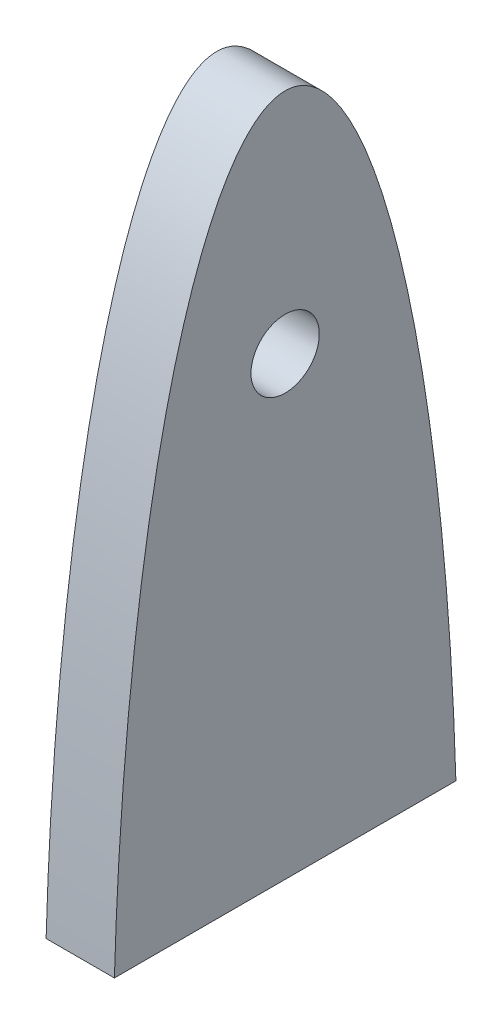
from build123d import *

# Parameters (mm, degrees)
SKETCH1_R           = 1.5
BOSS_EXTRUDE1_DEPTH = 3


with BuildPart() as part:
    # Sketch1 → Boss-Extrude1 (new body)
    with BuildSketch(Plane(origin=(3, 0, 0), x_dir=(0, 0, -1), z_dir=(1, 0, 0))):
        with BuildLine():
            Line((-7.5, 0), (7.5, 0))
            add(Edge.make_bspline(
                [(7.5, 0), (6.6, 30), (0, 30), (-6.6, 30), (-7.5, 0)],
                knots=[4.849178807, 4.849178807, 4.849178807, 6.283185307, 6.283185307, 7.717191807, 7.717191807, 7.717191807], degree=2, weights=[1, 0.753778361, 1, 0.753778361, 1]))
        make_face()
        with Locations(Location((0, 20, 0), (0, 0, 180))):
            Circle(SKETCH1_R, mode=Mode.SUBTRACT)
    extrude(amount=-BOSS_EXTRUDE1_DEPTH)


solid = part.part
